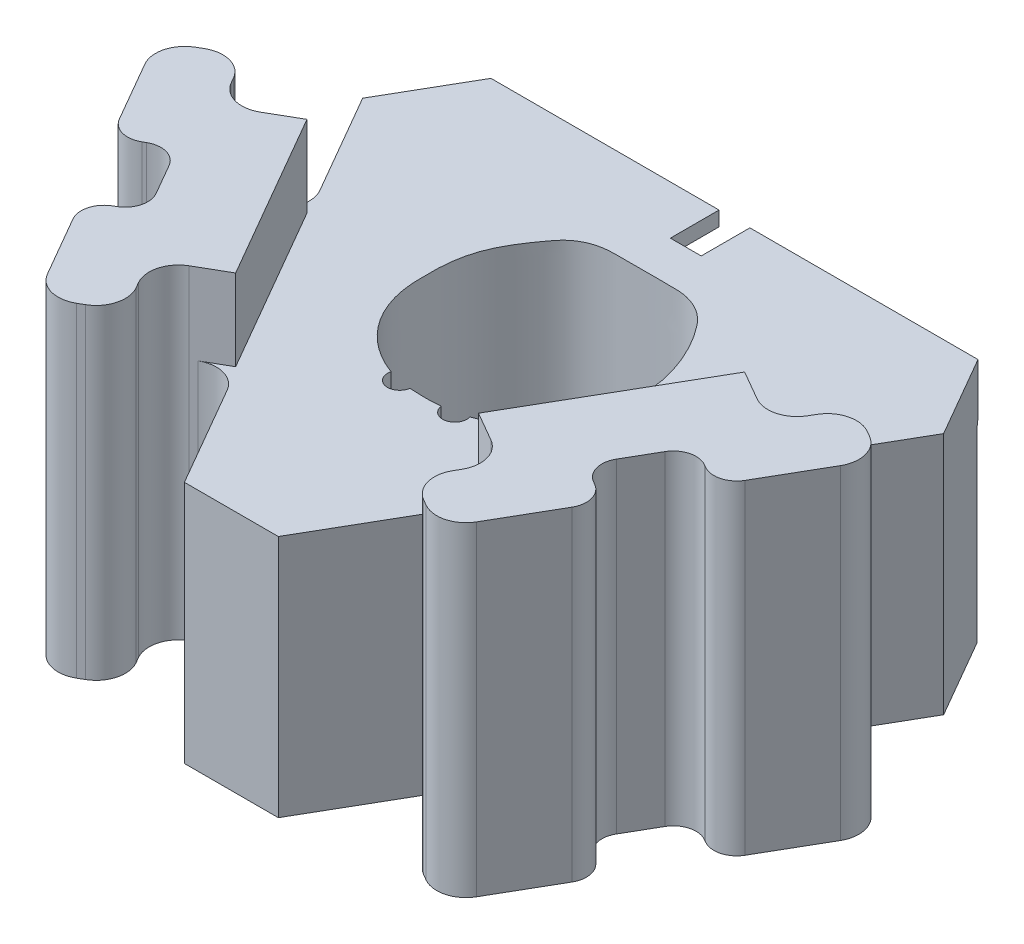
from build123d import *

# Parameters (mm, degrees)
BOSS_EXTRU_1_DEPTH      = 15
ENL_V_START             = -12
ESQUISSE4_R             = 1.5
ENL_V_MAT_EXTRU_4_DEPTH = 8
BOSS_EXTRU_2_DEPTH      = 20
CONG_5_R                = 1.8
ENL_V_START_2           = 15
ENL_V_MAT_EXTRU_5_DEPTH = 5
ESQUISSE7_R             = 1.5
ESQUISSE7_W             = 1.9
ESQUISSE7_H             = 0.1
ENL_V_MAT_EXTRU_6_DEPTH = 3
CONG_6_R                = 3
ESQUISSE8_R             = 0.75
ENL_V_MAT_EXTRU_7_DEPTH = 33.478642206


with BuildPart() as part:
    # Esquisse2 → Boss.-Extru.1 (new body)
    with BuildSketch(Plane(origin=(0, 0, 0), x_dir=(1, 0, 0), z_dir=(0, 1, 0))):
        Polygon((15, 12), (-15, 12), (-17.892304845, 6.990381057), (-2.892304845, -18.990381057), (2.892304845, -18.990381057), (17.892304845, 6.990381057), align=None)
        with BuildLine():
            add(Edge.make_bspline(
                [(-6.497795886, -0.435512169), (-6.562859024, 2.121494549), (-5.630578833, 3.64576447), (-3.901472034, 5.989881763), (-2.755958224, 6.442764065), (-0.876549045, 6.455616827), (1.132269087, 6.456305133), (2.764590803, 6.437211677), (3.915516646, 5.93683695), (5.68604085, 3.725822495), (6.557016299, 1.367317423), (6.496525421, -0.463293017), (6.514589536, -1.131908623), (6.247808359, -3.89361975), (4.327528544, -6.639389687), (0.544504956, -7.076982092), (-0.422677641, -7.064388331), (-3.088953313, -6.935277121), (-6.120558637, -4.860976426), (-6.514763181, -1.229822437), (-6.49155978, -0.658277257), (-6.497231202, -0.457704464), (-6.497795886, -0.435512169)],
                knots=[0, 0, 0, 0, 0.112371839, 0.130275732, 0.173620802, 0.187168536, 0.252205347, 0.266940035, 0.319780728, 0.343419676, 0.479690568, 0.498676785, 0.51429563, 0.54296722, 0.756721096, 0.785787005, 0.804560399, 0.825241089, 0.971913217, 0.99122251, 0.999024723, 1, 1, 1, 1], degree=3))
        make_face(mode=Mode.SUBTRACT)
    extrude(amount=BOSS_EXTRU_1_DEPTH)

    # Esquisse4 → Enlèv. mat.-Extru.4 (cut)
    with BuildSketch(Plane.XY.offset(ENL_V_START)):
        with Locations((-11, 11)):
            Circle(ESQUISSE4_R)
        with Locations((11, 11)):
            Circle(ESQUISSE4_R)
        with Locations((11, 3)):
            Circle(ESQUISSE4_R)
        with Locations((-11, 3)):
            Circle(ESQUISSE4_R)
    extrude(amount=ENL_V_MAT_EXTRU_4_DEPTH, mode=Mode.SUBTRACT)

    # Esquisse5 → Boss.-Extru.2 (add)
    with BuildSketch(Plane(origin=(0, 0, 0), x_dir=(1, 0, 0), z_dir=(0, 1, 0))):
        with BuildLine():
            Line((13.220508076, -17.101408311), (15.370508076, -13.377499075))
            ThreePointArc((15.370508076, -13.377499075), (15.510368667, -12.315152412), (14.85807251, -11.465063509))
            Line((14.85807251, -11.465063509), (14.68486743, -11.365063509))
            ThreePointArc((14.68486743, -11.365063509), (14.032571273, -10.514974607), (14.172431864, -9.452627944))
            Line((14.172431864, -9.452627944), (15.272431864, -7.547372056))
            ThreePointArc((15.272431864, -7.547372056), (16.122520766, -6.895075899), (17.18486743, -7.034936491))
            Line((17.18486743, -7.034936491), (17.35807251, -7.134936491))
            ThreePointArc((17.35807251, -7.134936491), (18.420419174, -7.274797082), (19.270508076, -6.622500925))
            Line((19.270508076, -6.622500925), (21.420508076, -2.898591689))
            ThreePointArc((21.420508076, -2.898591689), (21.600328836, -1.532717408), (20.761662349, -0.439745962))
            Line((20.761662349, -0.439745962), (20.415252187, -0.239745962))
            ThreePointArc((20.415252187, -0.239745962), (19.049377906, -0.059925202), (17.956406461, -0.898591689))
            Line((17.956406461, -0.898591689), (17.756406461, -1.24500185))
            ThreePointArc((17.756406461, -1.24500185), (16.663435015, -2.083668338), (15.297560734, -1.903847577))
            Line((15.297560734, -1.903847577), (13.392304845, -0.803847577))
            Line((13.392304845, -0.803847577), (7.392304845, -11.196152423))
            Line((7.392304845, -11.196152423), (9.297560734, -12.296152423))
            ThreePointArc((9.297560734, -12.296152423), (10.136227221, -13.389123868), (9.956406461, -14.75499815))
            Line((9.956406461, -14.75499815), (9.756406461, -15.101408311))
            ThreePointArc((9.756406461, -15.101408311), (9.5765857, -16.467282592), (10.415252187, -17.560254038))
            Line((10.415252187, -17.560254038), (10.761662349, -17.760254038))
            ThreePointArc((10.761662349, -17.760254038), (12.12753663, -17.940074798), (13.220508076, -17.101408311))
        make_face()
        with BuildLine():
            Line((-19.270508076, -6.622500925), (-21.420508076, -2.898591689))
            ThreePointArc((-21.420508076, -2.898591689), (-21.600328836, -1.532717408), (-20.761662349, -0.439745962))
            Line((-20.761662349, -0.439745962), (-20.415252187, -0.239745962))
            ThreePointArc((-20.415252187, -0.239745962), (-19.049377906, -0.059925202), (-17.956406461, -0.898591689))
            Line((-17.956406461, -0.898591689), (-17.756406461, -1.24500185))
            ThreePointArc((-17.756406461, -1.24500185), (-16.663435015, -2.083668338), (-15.297560734, -1.903847577))
            Line((-15.297560734, -1.903847577), (-13.392304845, -0.803847577))
            Line((-13.392304845, -0.803847577), (-7.392304845, -11.196152423))
            Line((-7.392304845, -11.196152423), (-9.297560734, -12.296152423))
            ThreePointArc((-9.297560734, -12.296152423), (-10.136227221, -13.389123868), (-9.956406461, -14.75499815))
            Line((-9.956406461, -14.75499815), (-9.756406461, -15.101408311))
            ThreePointArc((-9.756406461, -15.101408311), (-9.5765857, -16.467282592), (-10.415252187, -17.560254038))
            Line((-10.415252187, -17.560254038), (-10.761662349, -17.760254038))
            ThreePointArc((-10.761662349, -17.760254038), (-12.12753663, -17.940074798), (-13.220508076, -17.101408311))
            Line((-13.220508076, -17.101408311), (-15.370508076, -13.377499075))
            ThreePointArc((-15.370508076, -13.377499075), (-15.510368667, -12.315152412), (-14.85807251, -11.465063509))
            Line((-14.85807251, -11.465063509), (-14.68486743, -11.365063509))
            ThreePointArc((-14.68486743, -11.365063509), (-14.032571273, -10.514974607), (-14.172431864, -9.452627944))
            Line((-14.172431864, -9.452627944), (-15.272431864, -7.547372056))
            ThreePointArc((-15.272431864, -7.547372056), (-16.122520766, -6.895075899), (-17.18486743, -7.034936491))
            Line((-17.18486743, -7.034936491), (-17.35807251, -7.134936491))
            ThreePointArc((-17.35807251, -7.134936491), (-18.420419174, -7.274797082), (-19.270508076, -6.622500925))
        make_face()
    extrude(amount=BOSS_EXTRU_2_DEPTH)

    # Congé5
    cong_5_edges = [part.edges().sort_by_distance(p)[0] for p in [
        (7.392304845, 7.5, 11.196152423),
        (13.392304845, 7.5, 0.803847577),
        (-13.392304845, 7.5, 0.803847577),
        (-7.392304845, 7.5, 11.196152423),
    ]]
    fillet(cong_5_edges, radius=CONG_5_R)

    # Esquisse6 → Enlèv. mat.-Extru.5 (cut)
    with BuildSketch(Plane(origin=(0, 0, 0), x_dir=(1, 0, 0), z_dir=(0, 1, 0)).offset(ENL_V_START_2)):
        Polygon((-13.392304845, -0.803847577), (-7.392304845, -11.196152423), (-7.478907386, -11.246152423), (-13.478907386, -0.853847577), align=None)
        Polygon((7.392304845, -11.196152423), (13.392304845, -0.803847577), (13.478907386, -0.853847577), (7.478907386, -11.246152423), align=None)
    extrude(amount=ENL_V_MAT_EXTRU_5_DEPTH, mode=Mode.SUBTRACT)

    # Esquisse7 → Enlèv. mat.-Extru.6 (cut)
    # profile 1 of 3: a face of its own
    with BuildSketch(Plane(origin=(0, 0, -12), x_dir=(-1, 0, 0), z_dir=(0, 0, -1))):
        Polygon((15, 0), (0.85, 0), (-0.85, 0), (-15, 0), (-15, 14.1), (-15.1, 14.1), (-15.1, -0.1), (15.1, -0.1), (15.1, 14.1), (15, 14.1), align=None)
    # profile 2 of 3: a face of its own
    with BuildSketch(Plane(origin=(0, 0, -12), x_dir=(-1, 0, 0), z_dir=(0, 0, -1))):
        Polygon((-0.85, 0), (0.85, 0), (15, 0), (15, 14.1), (0.95, 14.1), (0.95, 15), (-0.95, 15), (-0.95, 14.1), (-15, 14.1), (-15, 0), align=None)
        with Locations((-11, 3)):
            Circle(ESQUISSE7_R, mode=Mode.SUBTRACT)
        with Locations((11, 3)):
            Circle(ESQUISSE7_R, mode=Mode.SUBTRACT)
        with Locations((-11, 11)):
            Circle(ESQUISSE7_R, mode=Mode.SUBTRACT)
        with Locations((11, 11)):
            Circle(ESQUISSE7_R, mode=Mode.SUBTRACT)
    # profile 3 of 3: a face of its own
    with BuildSketch(Plane(origin=(0, 0, -12), x_dir=(-1, 0, 0), z_dir=(0, 0, -1))):
        with Locations((0, 15.05)):
            Rectangle(ESQUISSE7_W, ESQUISSE7_H)
    extrude(amount=-ENL_V_MAT_EXTRU_6_DEPTH, mode=Mode.SUBTRACT)

    # Congé6
    cong_6_edges = [part.edges().sort_by_distance(p)[0] for p in [
        (-15.1, 14.1, -10.41339746),
        (15.1, 14.1, -10.41339746),
    ]]
    fillet(cong_6_edges, radius=CONG_6_R)

    # Esquisse8 → Enlèv. mat.-Extru.7 (cut, through all)
    with BuildSketch(Plane(origin=(0, 15, 0), x_dir=(1, 0, 0), z_dir=(0, 1, 0))):
        with Locations((-1.7, -6.924152718)):
            Circle(ESQUISSE8_R)
        with Locations((1.7, -6.924152718)):
            Circle(ESQUISSE8_R)
    extrude(amount=-ENL_V_MAT_EXTRU_7_DEPTH, mode=Mode.SUBTRACT)


solid = part.part
